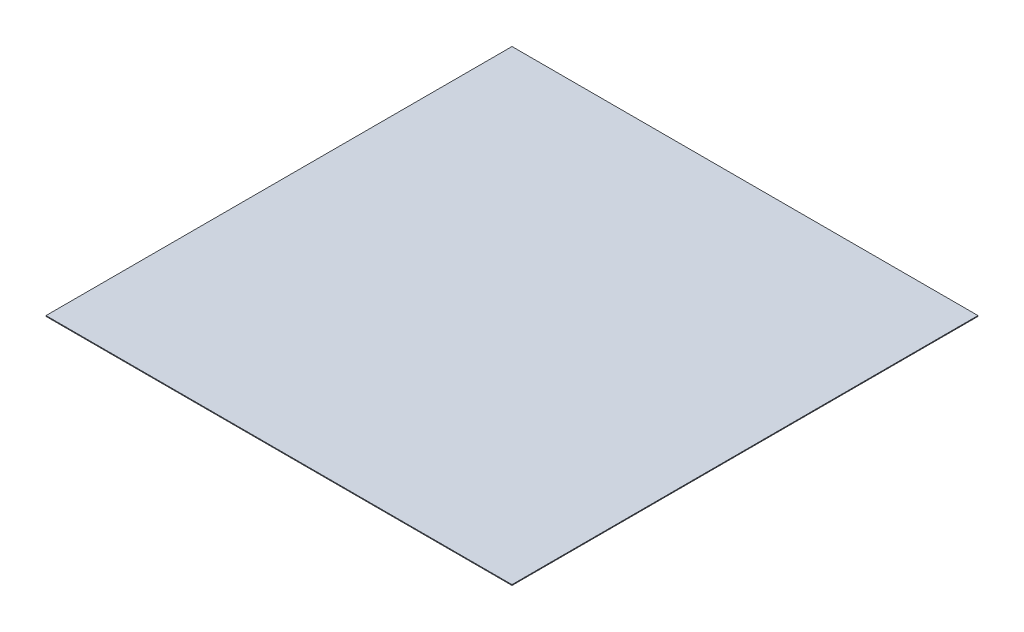
from build123d import *

# Parameters (mm, degrees)
SKETCH1_W           = 30
SKETCH1_H           = 30
BOSS_EXTRUDE1_DEPTH = 0.05


with BuildPart() as part:
    # Sketch1 → Boss-Extrude1 (new body)
    with BuildSketch(Plane(origin=(0, 0, 0), x_dir=(1, 0, 0), z_dir=(0, 1, 0))):
        Rectangle(SKETCH1_W, SKETCH1_H)
    extrude(amount=BOSS_EXTRUDE1_DEPTH)


solid = part.part
